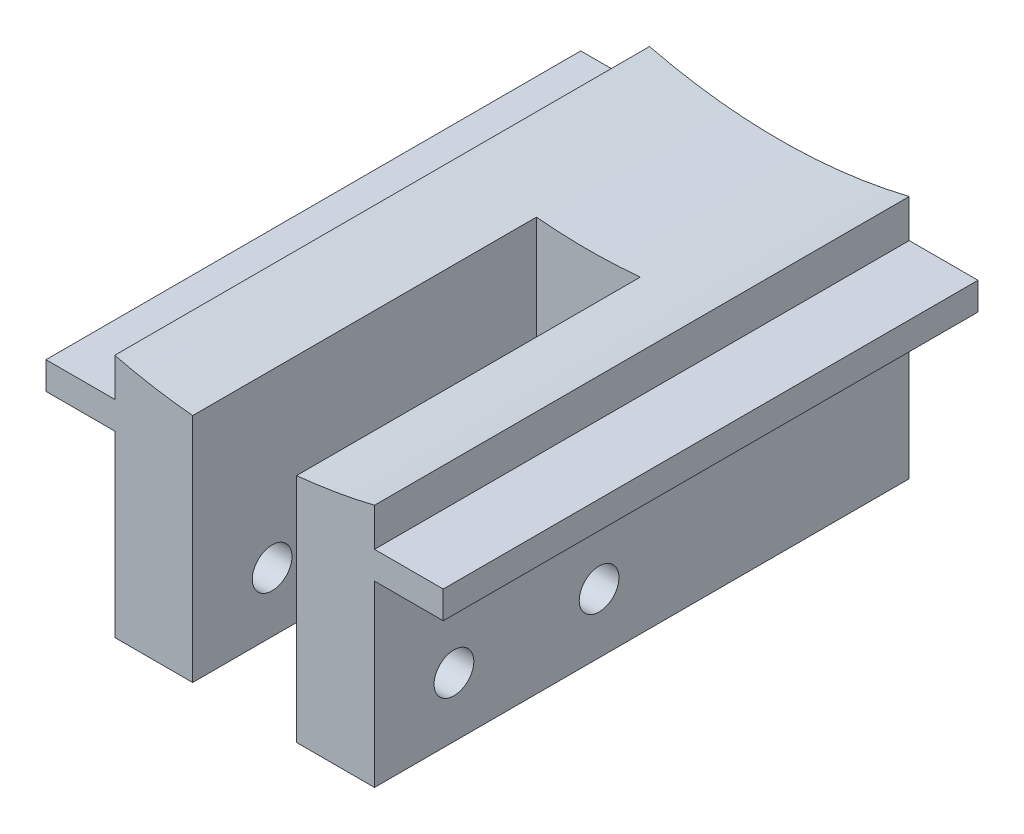
from build123d import *

# Parameters (mm, degrees)
EXTRUDE_1_DEPTH     = 35
CUT_EXTRUDE_1_DEPTH = 22.5
SKETCH_5_R          = 1.3
CUT_EXTRUDE_3_DEPTH = 40.724048132
SKETCH_6_W          = 4.5
SKETCH_6_H          = 1.8
EXTRUDE_2_DEPTH     = 35


with BuildPart() as part:
    # 草圖2 → 填料-伸長1 (new body)
    with BuildSketch(Plane.XY):
        with BuildLine():
            Line((-8.5, -8), (8.5, -8))
            Line((8.5, -8), (8.5, 8))
            ThreePointArc((8.5, 8), (0, 6.967375879), (-8.5, 8))
            Line((-8.5, 8), (-8.5, -8))
        make_face()
    extrude(amount=-EXTRUDE_1_DEPTH)

    # 草圖3 → 除料-伸長1 (cut)
    with BuildSketch(Plane.XY):
        with BuildLine():
            Line((-3.4, -8), (3.4, -8))
            Line((3.4, -8), (3.4, 7.130567874))
            ThreePointArc((3.4, 7.130567874), (0, 6.967375879), (-3.4, 7.130567874))
            Line((-3.4, 7.130567874), (-3.4, -8))
        make_face()
    extrude(amount=-CUT_EXTRUDE_1_DEPTH, mode=Mode.SUBTRACT)

    # 草圖5 → 除料-伸長3 (cut, through all)
    with BuildSketch(Plane.ZY.offset(8.5)):
        with Locations((-5.2, -4.1)):
            Circle(SKETCH_5_R)
        with Locations((-14.7, -4.1)):
            Circle(SKETCH_5_R)
    extrude(amount=-CUT_EXTRUDE_3_DEPTH, mode=Mode.SUBTRACT)

    # 草圖6 → 填料-伸長2 (add)
    with BuildSketch(Plane.XY):
        with Locations((10.75, 4.6)):
            Rectangle(SKETCH_6_W, SKETCH_6_H)
    extrude_2 = extrude(amount=-EXTRUDE_2_DEPTH)

    # 鏡射1: 填料-伸長2 across plane
    add(extrude_2.mirror(Plane(origin=(0, 0, 0), x_dir=(0, 0, 1), z_dir=(1, 0, 0))))


solid = part.part
